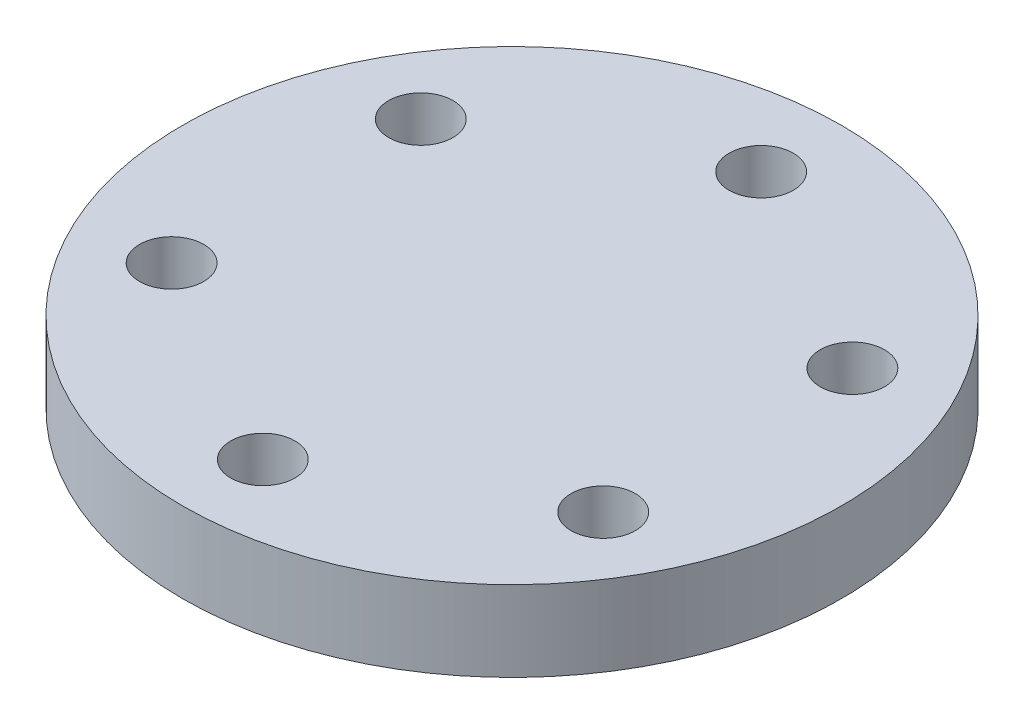
from build123d import *

# Parameters (mm, degrees)
SKETCH_1_R               = 20.5
EXTRUDE_1_DEPTH          = 5
CUT_EXTRUDE_1_REACH      = 31.419
SKETCH_2_R               = 2
PATTERN_CIRCULAR_1_COUNT = 6


with BuildPart() as part:
    # 草圖1 → 填料-伸長1 (new body)
    with BuildSketch(Plane(origin=(0, 0, 0), x_dir=(1, 0, 0), z_dir=(0, 1, 0))):
        with Locations(Location((0, 0, 0), (0, 0, 270))):
            Circle(SKETCH_1_R)
    extrude(amount=EXTRUDE_1_DEPTH)

    # 草圖2 → 除料-伸長1 (cut, up to next)
    with BuildSketch(Plane(origin=(0, 5, 0), x_dir=(1, 0, 0), z_dir=(0, 1, 0)), mode=Mode.PRIVATE) as cut_extrude_1_sk1:
        with Locations(Location((0, 15.5, 0), (0, 0, 270))):
            Circle(SKETCH_2_R)
    cut_extrude_1_tool1 = extrude(cut_extrude_1_sk1.sketch, amount=-CUT_EXTRUDE_1_REACH, mode=Mode.PRIVATE) & part.part
    cut_extrude_1 = cut_extrude_1_tool1.solids().sort_by_distance((0, 5, -15.5))[0]
    add(cut_extrude_1, mode=Mode.SUBTRACT)

    # 環狀複製排列1: 除料-伸長1 ×6 about axis
    pattern_circular_1_axis = Axis((0, 0, 0), (0, 1, 0))
    for i in range(1, PATTERN_CIRCULAR_1_COUNT):
        add(cut_extrude_1.rotate(pattern_circular_1_axis, i * 360 / PATTERN_CIRCULAR_1_COUNT), mode=Mode.SUBTRACT)


solid = part.part
